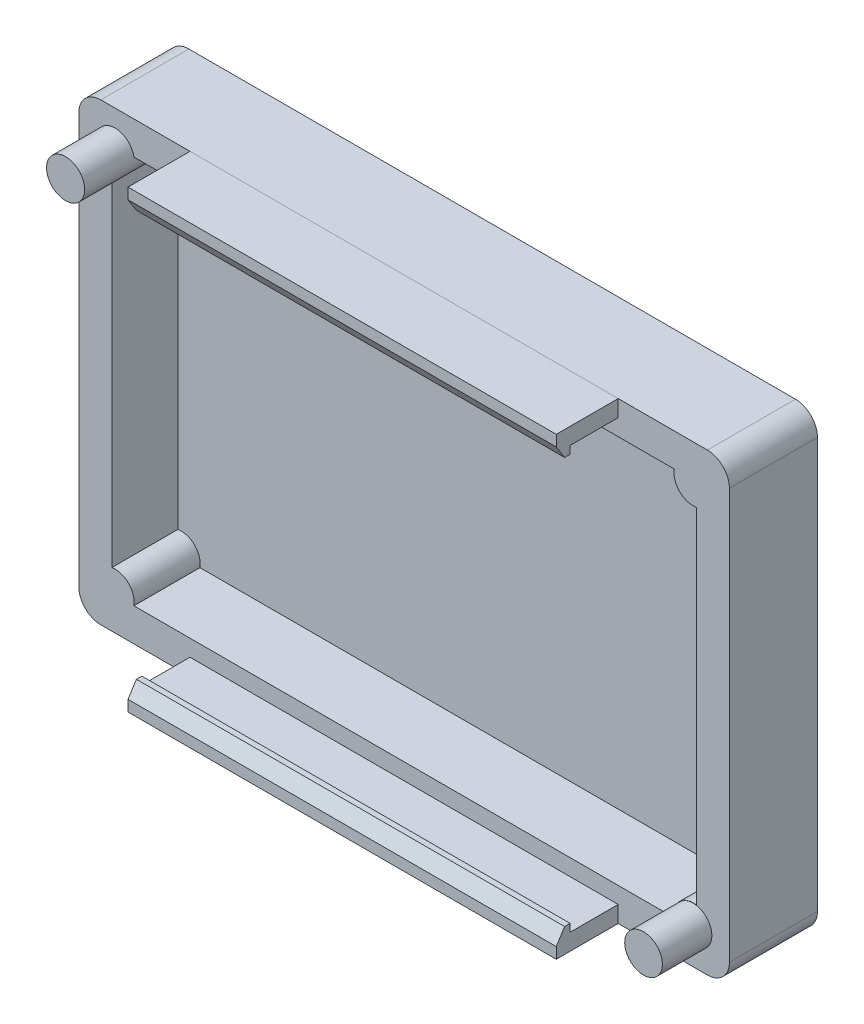
from build123d import *
from build123d.topology import SkipClean

# Parameters (mm, degrees)
SZKIC1_W                    = 59.100010001
SZKIC1_H                    = 41.299998987
DODANIE_WYCI_GNI_CIE1_DEPTH = 6
SZKIC2_W                    = 59.100010001
SZKIC2_H                    = 41.299998987
DODANIE_WYCI_GNI_CIE2_DEPTH = 2
DODANIE_WYCI_GNI_CIE3_DEPTH = 49
WYTNIJ_WYCI_GNI_CIE2_DEPTH  = 10.1
SZKIC10_R                   = 1.708928953
SZKIC10_R_2                 = 1.732000006
DODANIE_WYCI_GNI_CIE4_DEPTH = 4.5
ZAOKR_GLENIE2_R             = 2


with BuildPart() as part:
    # Szkic1 → Dodanie-wyciągnięcie1 (new body)
    with BuildSketch(Plane(origin=(0, 0, 48.142497501), x_dir=(-1, 0, 0), z_dir=(0, 0, -1))):
        with Locations((-0.56091645, -0.813328838)):
            Rectangle(SZKIC1_W, SZKIC1_H)
        with BuildLine():
            ThreePointArc((-27.11092145, 14.830852979), (-25.586268211, 15.311972573), (-25.105290748, 16.836670655))
            Line((-25.105290748, 16.836670655), (23.983285891, 16.836670655))
            ThreePointArc((23.983285891, 16.836670655), (24.464316114, 15.311856195), (25.989088551, 14.830692784))
            Line((25.989088551, 14.830692784), (25.989088551, -16.45750804))
            ThreePointArc((25.989088551, -16.45750804), (24.464318208, -16.938605941), (23.983068356, -18.463328332))
            Line((23.983068356, -18.463328332), (-25.105072686, -18.463328332))
            ThreePointArc((-25.105072686, -18.463328332), (-25.586269943, -16.938721956), (-27.11092145, -16.457667715))
            Line((-27.11092145, -16.457667715), (-27.11092145, 14.830852979))
        make_face(mode=Mode.SUBTRACT)
    extrude(amount=-DODANIE_WYCI_GNI_CIE1_DEPTH)

    # Szkic2 → Dodanie-wyciągnięcie2 (add)
    with BuildSketch(Plane(origin=(0, 0, 48.142497501), x_dir=(-1, 0, 0), z_dir=(0, 0, -1))):
        with Locations((-0.56091645, -0.813328838)):
            Rectangle(SZKIC2_W, SZKIC2_H)
    extrude(amount=DODANIE_WYCI_GNI_CIE2_DEPTH)

    # Szkic10 → Dodanie-wyciągnięcie4 (add)
    with SkipClean():  # the faces are left unmerged after this step: merging them gives an invalid solid
        with BuildSketch(Plane.XY.offset(54.142497501)):
            with Locations((26.81092145, -18.163488345)):
                Circle(SZKIC10_R)
            with Locations((-25.68907855, 16.536511655)):
                Circle(SZKIC10_R_2)
        extrude(amount=DODANIE_WYCI_GNI_CIE4_DEPTH)

    # Zaokrąglenie2
    zaokr_glenie2_edges = [part.edges().sort_by_distance(p)[0] for p in [
        (-28.989088551, 19.836670655, 50.142497501),
        (30.11092145, 19.836670655, 50.142497501),
        (30.11092145, -21.463328332, 50.142497501),
        (-28.989088551, -21.463328332, 50.142497501),
    ]]
    fillet(zaokr_glenie2_edges, radius=ZAOKR_GLENIE2_R)


with BuildPart() as body_2:
    # Szkic5 → Dodanie-wyciągnięcie3 (new body)
    with BuildSketch(Plane(origin=(30.11092145, 0, 0), x_dir=(0, 0, -1), z_dir=(1, 0, 0))):
        Polygon((-54.142497501, 19.836670655), (-59.768947352, 19.836670655), (-59.768947352, 18.836670655), (-59.012699001, 17.636670655), (-58.512699001, 17.636670655), (-58.512699001, 18.336670655), (-54.142497501, 18.336670655), align=None)
    extrude(amount=-DODANIE_WYCI_GNI_CIE3_DEPTH)

    # Szkic5<2> → Wytnij-wyciągnięcie2 (cut)
    with BuildSketch(Plane(origin=(30.11092145, 0, 0), x_dir=(0, 0, -1), z_dir=(1, 0, 0))):
        Polygon((-54.142497501, 19.836670655), (-59.768947352, 19.836670655), (-59.768947352, 18.836670655), (-59.012699001, 17.636670655), (-58.512699001, 17.636670655), (-58.512699001, 18.336670655), (-54.142497501, 18.336670655), align=None)
    extrude(amount=-WYTNIJ_WYCI_GNI_CIE2_DEPTH, mode=Mode.SUBTRACT)


with BuildPart() as body_3:
    # Lustro3: mirrored copy
    add(body_2.part.mirror(Plane(origin=(0, -0.813328839, 0), x_dir=(0, 0, 1), z_dir=(0, -1, 0))))


solid = Compound([part.part, body_2.part, body_3.part])
